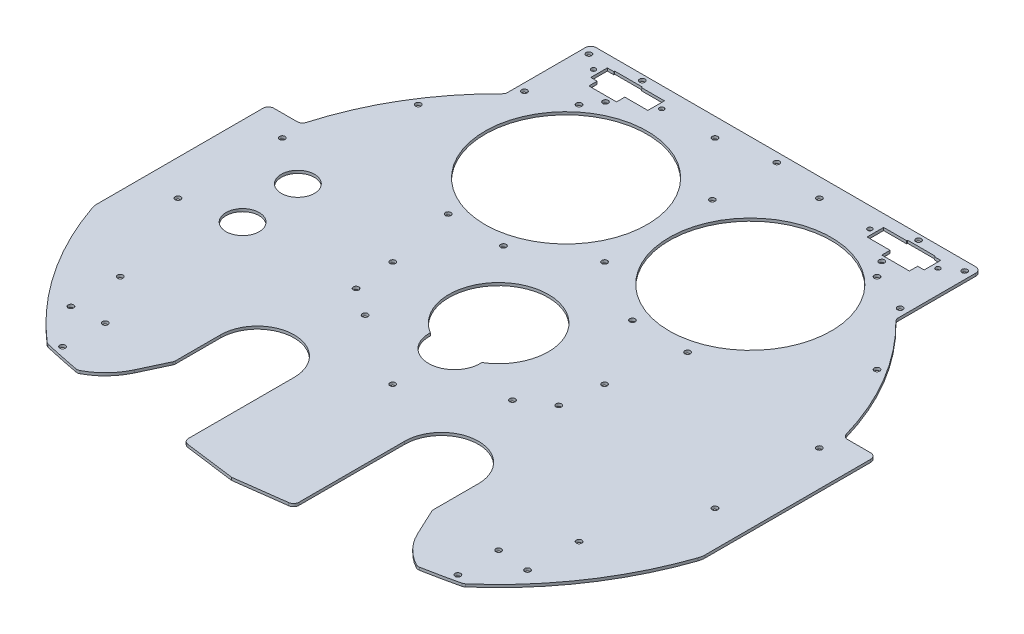
from build123d import *

# Parameters (mm, degrees)
BOSS_EXTRU_1_DEPTH           = 1.5
ESQUISSE2_R                  = 1.5
ENL_V_MAT_EXTRU_1_DEPTH      = 10
ENL_V_MAT_EXTRU_2_REACH      = 231.842
ESQUISSE3_R                  = 44
ESQUISSE3_R_2                = 1.25
ESQUISSE3_W                  = 31
ESQUISSE3_H                  = 9
ENL_V_MAT_EXTRU_3_REACH      = 231.842
ESQUISSE4_R                  = 1.5
CONG_1_R                     = 3
ESQUISSE5_R                  = 9
ENL_V_MAT_EXTRU_4_DEPTH      = 230.841793557
ESQUISSE6_R                  = 1.5
ENL_V_MAT_EXTRU_5_DEPTH      = 230.841793557
R_P_TITION_CIRCULAIRE1_COUNT = 3
R_P_TITION_CIRCULAIRE1_ANGLE = 180
ESQUISSE7_R                  = 1.5
ENL_V_MAT_EXTRU_6_DEPTH      = 230.841793557
CONG_2_R                     = 10
CONG_3_R                     = 3
ESQUISSE8_R                  = 1.5
ESQUISSE8_W                  = 15
ESQUISSE8_H                  = 14
ENL_V_MAT_EXTRU_7_DEPTH      = 228.075428139
ESQUISSE9_R                  = 1.5
ENL_V_MAT_EXTRU_8_DEPTH      = 3
ESQUISSE10_R                 = 1.5
ENL_V_MAT_EXTRU_9_DEPTH      = 228.075428139


with BuildPart() as part:
    # Esquisse1 → Boss.-Extru.1 (new body)
    with BuildSketch(Plane(origin=(0, 0, 0), x_dir=(1, 0, 0), z_dir=(0, 1, 0))):
        with BuildLine():
            Line((165, -54.556978373), (165, 55.241669751))
            Line((165, 55.241669751), (104.517749831, 160))
            Line((104.517749831, 160), (-104.517749831, 160))
            Line((-104.517749831, 160), (-165, 55.241669751))
            Line((-165, 55.241669751), (-165, -54.556978373))
            ThreePointArc((-165, -54.556978373), (-144.278322914, -96.877393783), (-112.949332972, -132.075402973))
            ThreePointArc((-112.949332972, -132.075402973), (0, -145), (112.949332972, -132.075402973))
            ThreePointArc((112.949332972, -132.075402973), (144.278322914, -96.877393783), (165, -54.556978373))
        make_face()
    extrude(amount=BOSS_EXTRU_1_DEPTH)

    # Esquisse2 → Enlèv. mat.-Extru.1 (cut)
    with BuildSketch(Plane(origin=(0, 1.5, 0), x_dir=(1, 0, 0), z_dir=(0, 1, 0))):
        with Locations(Location((0, 57.5, 0), (0, 0, 270))):
            Circle(ESQUISSE2_R)
        with Locations(Location((57.5, 0, 0), (0, 0, 270))):
            Circle(ESQUISSE2_R)
        with Locations(Location((-57.5, 0, 0), (0, 0, 270))):
            Circle(ESQUISSE2_R)
        with Locations(Location((0, -57.5, 0), (0, 0, 270))):
            Circle(ESQUISSE2_R)
        with BuildLine():
            ThreePointArc((13.971309267, -23.104166667), (0, 27), (-13.971309267, -23.104166667))
            ThreePointArc((-13.971309267, -23.104166667), (0, -38), (13.971309267, -23.104166667))
        make_face()
    extrude(amount=-ENL_V_MAT_EXTRU_1_DEPTH, mode=Mode.SUBTRACT)

    # Esquisse3 → Enlèv. mat.-Extru.2 (cut, up to next)
    with BuildSketch(Plane(origin=(0, 1.5, 0), x_dir=(1, 0, 0), z_dir=(0, 1, 0)), mode=Mode.PRIVATE) as enl_v_mat_extru_2_sk1:
        with Locations(Location((-50, 86.602540378, 0), (0, 0, 270))):
            Circle(ESQUISSE3_R)
    enl_v_mat_extru_2_tool1 = extrude(enl_v_mat_extru_2_sk1.sketch, amount=-ENL_V_MAT_EXTRU_2_REACH, mode=Mode.PRIVATE) & part.part
    # Esquisse3 → Enlèv. mat.-Extru.2 (cut, up to next)
    with BuildSketch(Plane(origin=(0, 1.5, 0), x_dir=(1, 0, 0), z_dir=(0, 1, 0)), mode=Mode.PRIVATE) as enl_v_mat_extru_2_sk2:
        with Locations(Location((50, 86.602540378, 0), (0, 0, 270))):
            Circle(ESQUISSE3_R)
    enl_v_mat_extru_2_tool2 = extrude(enl_v_mat_extru_2_sk2.sketch, amount=-ENL_V_MAT_EXTRU_2_REACH, mode=Mode.PRIVATE) & part.part
    # Esquisse3 → Enlèv. mat.-Extru.2 (cut, up to next)
    with BuildSketch(Plane(origin=(0, 1.5, 0), x_dir=(1, 0, 0), z_dir=(0, 1, 0)), mode=Mode.PRIVATE) as enl_v_mat_extru_2_sk3:
        with Locations(Location((-93.5, 145, 0), (0, 0, 270))):
            Circle(ESQUISSE3_R_2)
    enl_v_mat_extru_2_tool3 = extrude(enl_v_mat_extru_2_sk3.sketch, amount=-ENL_V_MAT_EXTRU_2_REACH, mode=Mode.PRIVATE) & part.part
    # Esquisse3 → Enlèv. mat.-Extru.2 (cut, up to next)
    with BuildSketch(Plane(origin=(0, 1.5, 0), x_dir=(1, 0, 0), z_dir=(0, 1, 0)), mode=Mode.PRIVATE) as enl_v_mat_extru_2_sk4:
        with Locations(Location((-56.5, 145, 0), (0, 0, 270))):
            Circle(ESQUISSE3_R_2)
    enl_v_mat_extru_2_tool4 = extrude(enl_v_mat_extru_2_sk4.sketch, amount=-ENL_V_MAT_EXTRU_2_REACH, mode=Mode.PRIVATE) & part.part
    # Esquisse3 → Enlèv. mat.-Extru.2 (cut, up to next)
    with BuildSketch(Plane(origin=(0, 1.5, 0), x_dir=(1, 0, 0), z_dir=(0, 1, 0)), mode=Mode.PRIVATE) as enl_v_mat_extru_2_sk5:
        with Locations(Location((56.5, 145, 0), (0, 0, 270))):
            Circle(ESQUISSE3_R_2)
    enl_v_mat_extru_2_tool5 = extrude(enl_v_mat_extru_2_sk5.sketch, amount=-ENL_V_MAT_EXTRU_2_REACH, mode=Mode.PRIVATE) & part.part
    # Esquisse3 → Enlèv. mat.-Extru.2 (cut, up to next)
    with BuildSketch(Plane(origin=(0, 1.5, 0), x_dir=(1, 0, 0), z_dir=(0, 1, 0)), mode=Mode.PRIVATE) as enl_v_mat_extru_2_sk6:
        with Locations(Location((93.5, 145, 0), (0, 0, 270))):
            Circle(ESQUISSE3_R_2)
    enl_v_mat_extru_2_tool6 = extrude(enl_v_mat_extru_2_sk6.sketch, amount=-ENL_V_MAT_EXTRU_2_REACH, mode=Mode.PRIVATE) & part.part
    # Esquisse3 → Enlèv. mat.-Extru.2 (cut, up to next)
    with BuildSketch(Plane(origin=(0, 1.5, 0), x_dir=(1, 0, 0), z_dir=(0, 1, 0)), mode=Mode.PRIVATE) as enl_v_mat_extru_2_sk7:
        with Locations((-75, 145)):
            Rectangle(ESQUISSE3_W, ESQUISSE3_H)
    enl_v_mat_extru_2_tool7 = extrude(enl_v_mat_extru_2_sk7.sketch, amount=-ENL_V_MAT_EXTRU_2_REACH, mode=Mode.PRIVATE) & part.part
    # Esquisse3 → Enlèv. mat.-Extru.2 (cut, up to next)
    with BuildSketch(Plane(origin=(0, 1.5, 0), x_dir=(1, 0, 0), z_dir=(0, 1, 0)), mode=Mode.PRIVATE) as enl_v_mat_extru_2_sk8:
        with BuildLine():
            Line((70, -145), (70, -81))
            ThreePointArc((70, -81), (50, -61), (30, -81))
            Line((30, -81), (30, -145))
            Line((30, -145), (70, -145))
        make_face()
    enl_v_mat_extru_2_tool8 = extrude(enl_v_mat_extru_2_sk8.sketch, amount=-ENL_V_MAT_EXTRU_2_REACH, mode=Mode.PRIVATE) & part.part
    # Esquisse3 → Enlèv. mat.-Extru.2 (cut, up to next)
    with BuildSketch(Plane(origin=(0, 1.5, 0), x_dir=(1, 0, 0), z_dir=(0, 1, 0)), mode=Mode.PRIVATE) as enl_v_mat_extru_2_sk9:
        with BuildLine():
            Line((-30, -145), (-70, -145))
            Line((-70, -145), (-70, -81))
            ThreePointArc((-70, -81), (-50, -61), (-30, -81))
            Line((-30, -81), (-30, -145))
        make_face()
    enl_v_mat_extru_2_tool9 = extrude(enl_v_mat_extru_2_sk9.sketch, amount=-ENL_V_MAT_EXTRU_2_REACH, mode=Mode.PRIVATE) & part.part
    # Esquisse3 → Enlèv. mat.-Extru.2 (cut, up to next)
    with BuildSketch(Plane(origin=(0, 1.5, 0), x_dir=(1, 0, 0), z_dir=(0, 1, 0)), mode=Mode.PRIVATE) as enl_v_mat_extru_2_sk10:
        with Locations((75, 145)):
            Rectangle(ESQUISSE3_W, ESQUISSE3_H)
    enl_v_mat_extru_2_tool10 = extrude(enl_v_mat_extru_2_sk10.sketch, amount=-ENL_V_MAT_EXTRU_2_REACH, mode=Mode.PRIVATE) & part.part
    add(enl_v_mat_extru_2_tool1.solids().sort_by_distance((-50, 1.5, -86.60254))[0], mode=Mode.SUBTRACT)
    add(enl_v_mat_extru_2_tool2.solids().sort_by_distance((50, 1.5, -86.60254))[0], mode=Mode.SUBTRACT)
    add(enl_v_mat_extru_2_tool3.solids().sort_by_distance((-93.5, 1.5, -145))[0], mode=Mode.SUBTRACT)
    add(enl_v_mat_extru_2_tool4.solids().sort_by_distance((-56.5, 1.5, -145))[0], mode=Mode.SUBTRACT)
    add(enl_v_mat_extru_2_tool5.solids().sort_by_distance((56.5, 1.5, -145))[0], mode=Mode.SUBTRACT)
    add(enl_v_mat_extru_2_tool6.solids().sort_by_distance((93.5, 1.5, -145))[0], mode=Mode.SUBTRACT)
    add(enl_v_mat_extru_2_tool7.solids().sort_by_distance((-75, 1.5, -145))[0], mode=Mode.SUBTRACT)
    add(enl_v_mat_extru_2_tool8.solids().sort_by_distance((50, 1.5, 105.021021))[0], mode=Mode.SUBTRACT)
    add(enl_v_mat_extru_2_tool9.solids().sort_by_distance((-50, 1.5, 105.021021))[0], mode=Mode.SUBTRACT)
    add(enl_v_mat_extru_2_tool10.solids().sort_by_distance((75, 1.5, -145))[0], mode=Mode.SUBTRACT)

    # Esquisse4 → Enlèv. mat.-Extru.3 (cut, up to next)
    with BuildSketch(Plane(origin=(0, 1.5, 0), x_dir=(1, 0, 0), z_dir=(0, 1, 0)), mode=Mode.PRIVATE) as enl_v_mat_extru_3_sk1:
        with Locations(Location((-106.773123959, -106.773123959, 0), (0, 0, 270))):
            Circle(ESQUISSE4_R)
    enl_v_mat_extru_3_tool1 = extrude(enl_v_mat_extru_3_sk1.sketch, amount=-ENL_V_MAT_EXTRU_3_REACH, mode=Mode.PRIVATE) & part.part
    # Esquisse4 → Enlèv. mat.-Extru.3 (cut, up to next)
    with BuildSketch(Plane(origin=(0, 1.5, 0), x_dir=(1, 0, 0), z_dir=(0, 1, 0)), mode=Mode.PRIVATE) as enl_v_mat_extru_3_sk2:
        with Locations(Location((106.773123959, -106.773123959, 0), (0, 0, 270))):
            Circle(ESQUISSE4_R)
    enl_v_mat_extru_3_tool2 = extrude(enl_v_mat_extru_3_sk2.sketch, amount=-ENL_V_MAT_EXTRU_3_REACH, mode=Mode.PRIVATE) & part.part
    # Esquisse4 → Enlèv. mat.-Extru.3 (cut, up to next)
    with BuildSketch(Plane(origin=(0, 1.5, 0), x_dir=(1, 0, 0), z_dir=(0, 1, 0)), mode=Mode.PRIVATE) as enl_v_mat_extru_3_sk3:
        with Locations(Location((107.303108891, -129.437836945, 0), (0, 0, 270))):
            Circle(ESQUISSE4_R)
    enl_v_mat_extru_3_tool3 = extrude(enl_v_mat_extru_3_sk3.sketch, amount=-ENL_V_MAT_EXTRU_3_REACH, mode=Mode.PRIVATE) & part.part
    # Esquisse4 → Enlèv. mat.-Extru.3 (cut, up to next)
    with BuildSketch(Plane(origin=(0, 1.5, 0), x_dir=(1, 0, 0), z_dir=(0, 1, 0)), mode=Mode.PRIVATE) as enl_v_mat_extru_3_sk4:
        with Locations(Location((123.953743986, -108.277582907, 0), (0, 0, 270))):
            Circle(ESQUISSE4_R)
    enl_v_mat_extru_3_tool4 = extrude(enl_v_mat_extru_3_sk4.sketch, amount=-ENL_V_MAT_EXTRU_3_REACH, mode=Mode.PRIVATE) & part.part
    # Esquisse4 → Enlèv. mat.-Extru.3 (cut, up to next)
    with BuildSketch(Plane(origin=(0, 1.5, 0), x_dir=(1, 0, 0), z_dir=(0, 1, 0)), mode=Mode.PRIVATE) as enl_v_mat_extru_3_sk5:
        with Locations(Location((-123.953743986, -108.277582907, 0), (0, 0, 270))):
            Circle(ESQUISSE4_R)
    enl_v_mat_extru_3_tool5 = extrude(enl_v_mat_extru_3_sk5.sketch, amount=-ENL_V_MAT_EXTRU_3_REACH, mode=Mode.PRIVATE) & part.part
    # Esquisse4 → Enlèv. mat.-Extru.3 (cut, up to next)
    with BuildSketch(Plane(origin=(0, 1.5, 0), x_dir=(1, 0, 0), z_dir=(0, 1, 0)), mode=Mode.PRIVATE) as enl_v_mat_extru_3_sk6:
        with Locations(Location((-107.303108891, -129.437836945, 0), (0, 0, 270))):
            Circle(ESQUISSE4_R)
    enl_v_mat_extru_3_tool6 = extrude(enl_v_mat_extru_3_sk6.sketch, amount=-ENL_V_MAT_EXTRU_3_REACH, mode=Mode.PRIVATE) & part.part
    # Esquisse4 → Enlèv. mat.-Extru.3 (cut, up to next)
    with BuildSketch(Plane(origin=(0, 1.5, 0), x_dir=(1, 0, 0), z_dir=(0, 1, 0)), mode=Mode.PRIVATE) as enl_v_mat_extru_3_sk7:
        with BuildLine():
            Line((-70, -105.997557384), (-76.864966987, -120.719526597))
            ThreePointArc((-76.864966987, -120.719526597), (-89.156485892, -134.677497509), (-107.043695945, -139.77201471))
            Line((-107.043695945, -139.77201471), (-70, -140.075751779))
            Line((-70, -140.075751779), (-70, -105.997557384))
        make_face()
    enl_v_mat_extru_3_tool7 = extrude(enl_v_mat_extru_3_sk7.sketch, amount=-ENL_V_MAT_EXTRU_3_REACH, mode=Mode.PRIVATE) & part.part
    # Esquisse4 → Enlèv. mat.-Extru.3 (cut, up to next)
    with BuildSketch(Plane(origin=(0, 1.5, 0), x_dir=(1, 0, 0), z_dir=(0, 1, 0)), mode=Mode.PRIVATE) as enl_v_mat_extru_3_sk8:
        with BuildLine():
            Line((70, -105.997557384), (70, -140.075751779))
            Line((70, -140.075751779), (107.043695945, -139.77201471))
            ThreePointArc((107.043695945, -139.77201471), (89.156485892, -134.677497509), (76.864966987, -120.719526597))
            Line((76.864966987, -120.719526597), (70, -105.997557384))
        make_face()
    enl_v_mat_extru_3_tool8 = extrude(enl_v_mat_extru_3_sk8.sketch, amount=-ENL_V_MAT_EXTRU_3_REACH, mode=Mode.PRIVATE) & part.part
    # Esquisse4 → Enlèv. mat.-Extru.3 (cut, up to next)
    with BuildSketch(Plane(origin=(0, 1.5, 0), x_dir=(1, 0, 0), z_dir=(0, 1, 0)), mode=Mode.PRIVATE) as enl_v_mat_extru_3_sk9:
        Polygon((-30, -145), (30, -145), (30, -141.012303502), (0, -144.961878429), (-30, -141.012303502), align=None)
    enl_v_mat_extru_3_tool9 = extrude(enl_v_mat_extru_3_sk9.sketch, amount=-ENL_V_MAT_EXTRU_3_REACH, mode=Mode.PRIVATE) & part.part
    add(enl_v_mat_extru_3_tool1.solids().sort_by_distance((-106.773124, 1.5, 106.773124))[0], mode=Mode.SUBTRACT)
    add(enl_v_mat_extru_3_tool2.solids().sort_by_distance((106.773124, 1.5, 106.773124))[0], mode=Mode.SUBTRACT)
    add(enl_v_mat_extru_3_tool3.solids().sort_by_distance((107.303109, 1.5, 129.437837))[0], mode=Mode.SUBTRACT)
    add(enl_v_mat_extru_3_tool4.solids().sort_by_distance((123.953744, 1.5, 108.277583))[0], mode=Mode.SUBTRACT)
    add(enl_v_mat_extru_3_tool5.solids().sort_by_distance((-123.953744, 1.5, 108.277583))[0], mode=Mode.SUBTRACT)
    add(enl_v_mat_extru_3_tool6.solids().sort_by_distance((-107.303109, 1.5, 129.437837))[0], mode=Mode.SUBTRACT)
    add(enl_v_mat_extru_3_tool7.solids().sort_by_distance((-78.222446, 1.5, 130.278178))[0], mode=Mode.SUBTRACT)
    add(enl_v_mat_extru_3_tool8.solids().sort_by_distance((78.222446, 1.5, 130.278178))[0], mode=Mode.SUBTRACT)
    add(enl_v_mat_extru_3_tool9.solids().sort_by_distance((29.398676, 1.5, 143.006152))[0], mode=Mode.SUBTRACT)

    # Congé1
    cong_1_edges = [part.edges().sort_by_distance(p)[0] for p in [
        (-112.949332972, 0.75, 132.075402973),
        (112.949332972, 0.75, 132.075402973),
        (-92.265847958, 0.75, 136.413281567),
        (-70, 0.75, 105.997557384),
        (70, 0.75, 105.997557384),
        (92.265847958, 0.75, 136.413281567),
        (-30, 0.75, 141.012303502),
        (30, 0.75, 141.012303502),
    ]]
    fillet(cong_1_edges, radius=CONG_1_R)

    # Esquisse5 → Enlèv. mat.-Extru.4 (cut, through all)
    with BuildSketch(Plane(origin=(0, 1.5, 0), x_dir=(1, 0, 0), z_dir=(0, 1, 0))):
        with Locations(Location((-120, 11, 0), (0, 0, 270))):
            Circle(ESQUISSE5_R)
        with Locations(Location((-117, -22, 0), (0, 0, 270))):
            Circle(ESQUISSE5_R)
    extrude(amount=-ENL_V_MAT_EXTRU_4_DEPTH, mode=Mode.SUBTRACT)

    # Esquisse6 → Enlèv. mat.-Extru.5 (cut, through all)
    with BuildSketch(Plane(origin=(0, 1.5, 0), x_dir=(1, 0, 0), z_dir=(0, 1, 0))):
        with Locations(Location((-124.54257934, -80.8788967, 0), (0, 0, 270))):
            Circle(ESQUISSE6_R)
        with Locations(Location((-145.771636742, -28.335135813, 0), (0, 0, 270))):
            Circle(ESQUISSE6_R)
        with Locations(Location((-145.771636742, 28.335135813, 0), (0, 0, 270))):
            Circle(ESQUISSE6_R)
        with Locations(Location((-124.54257934, 80.8788967, 0), (0, 0, 270))):
            Circle(ESQUISSE6_R)
    enl_v_mat_extru_5 = extrude(amount=-ENL_V_MAT_EXTRU_5_DEPTH, mode=Mode.SUBTRACT)

    # Répétition circulaire1: Enlèv. mat.-Extru.5 ×3 about axis
    r_p_tition_circulaire1_axis = Axis((0, 0, 0), (0, -1, 0))
    for i in range(1, R_P_TITION_CIRCULAIRE1_COUNT):
        add(enl_v_mat_extru_5.rotate(r_p_tition_circulaire1_axis, i * R_P_TITION_CIRCULAIRE1_ANGLE / (R_P_TITION_CIRCULAIRE1_COUNT - 1)), mode=Mode.SUBTRACT)

    # Esquisse7 → Enlèv. mat.-Extru.6 (cut, through all)
    with BuildSketch(Plane(origin=(0, 1.5, 0), x_dir=(1, 0, 0), z_dir=(0, 1, 0))):
        with Locations(Location((-65, 37.6, 0), (0, 0, 270))):
            Circle(ESQUISSE7_R)
        with Locations(Location((-35, 37.6, 0), (0, 0, 270))):
            Circle(ESQUISSE7_R)
        with Locations(Location((-55, -22.4, 0), (0, 0, 270))):
            Circle(ESQUISSE7_R)
        with Locations(Location((55, -22.4, 0), (0, 0, 90))):
            Circle(ESQUISSE7_R)
        with Locations(Location((35, 37.6, 0), (0, 0, 90))):
            Circle(ESQUISSE7_R)
        with Locations(Location((65, 37.6, 0), (0, 0, 90))):
            Circle(ESQUISSE7_R)
        with BuildLine():
            Line((-165, 55.241669751), (-165, 40))
            Line((-165, 40), (-147.160626528, 40))
            ThreePointArc((-147.160626528, 40), (-131.281758792, 77.597356968), (-106, 109.636900722))
            Line((-106, 109.636900722), (-106, 156))
            Line((-106, 156), (106, 156))
            Line((106, 156), (106, 109.636900722))
            ThreePointArc((106, 109.636900722), (131.281758792, 77.597356968), (147.160626528, 40))
            Line((147.160626528, 40), (165, 40))
            Line((165, 40), (165, 55.241669751))
            Line((165, 55.241669751), (104.517749831, 160))
            Line((104.517749831, 160), (-104.517749831, 160))
            Line((-104.517749831, 160), (-165, 55.241669751))
        make_face()
    extrude(amount=-ENL_V_MAT_EXTRU_6_DEPTH, mode=Mode.SUBTRACT)

    # Congé2
    cong_2_edges = [part.edges().sort_by_distance(p)[0] for p in [
        (-165, 0.75, 54.556978373),
        (165, 0.75, 54.556978373),
    ]]
    fillet(cong_2_edges, radius=CONG_2_R)

    # Congé3
    cong_3_edges = [part.edges().sort_by_distance(p)[0] for p in [
        (165, 0.75, -40),
        (147.160626528, 0.75, -40),
        (106, 0.75, -109.636900722),
        (106, 0.75, -156),
        (-106, 0.75, -156),
        (-106, 0.75, -109.636900722),
        (-147.160626528, 0.75, -40),
        (-165, 0.75, -40),
    ]]
    fillet(cong_3_edges, radius=CONG_3_R)

    # Esquisse8 → Enlèv. mat.-Extru.7 (cut, through all)
    with BuildSketch(Plane(origin=(0, 1.5, 0), x_dir=(1, 0, 0), z_dir=(0, 1, 0))):
        with Locations(Location((75, 133, 0), (0, 0, 90))):
            Circle(ESQUISSE8_R)
        with Locations(Location((-75, 153, 0), (0, 0, 270))):
            Circle(ESQUISSE8_R)
        with Locations(Location((75, 153, 0), (0, 0, 90))):
            Circle(ESQUISSE8_R)
        with Locations(Location((-75, 133, 0), (0, 0, 270))):
            Circle(ESQUISSE8_R)
        with Locations((-79.5, 143)):
            Rectangle(ESQUISSE8_W, ESQUISSE8_H)
        with Locations((79.5, 143)):
            Rectangle(ESQUISSE8_W, ESQUISSE8_H)
    extrude(amount=-ENL_V_MAT_EXTRU_7_DEPTH, mode=Mode.SUBTRACT)

    # Esquisse9 → Enlèv. mat.-Extru.8 (cut)
    with BuildSketch(Plane(origin=(0, 1.5, 0), x_dir=(1, 0, 0), z_dir=(0, 1, 0))):
        with Locations(Location((-102, 151, 0), (0, 0, 270))):
            Circle(ESQUISSE9_R)
        with Locations(Location((0, 151, 0), (0, 0, 270))):
            Circle(ESQUISSE9_R)
        with Locations(Location((102, 151, 0), (0, 0, 270))):
            Circle(ESQUISSE9_R)
        with Locations(Location((0, 116, 0), (0, 0, 270))):
            Circle(ESQUISSE9_R)
        with Locations(Location((102, 116, 0), (0, 0, 270))):
            Circle(ESQUISSE9_R)
        with Locations(Location((-102, 116, 0), (0, 0, 270))):
            Circle(ESQUISSE9_R)
    extrude(amount=-ENL_V_MAT_EXTRU_8_DEPTH, mode=Mode.SUBTRACT)

    # Esquisse10 → Enlèv. mat.-Extru.9 (cut, through all)
    with BuildSketch(Plane(origin=(0, 1.5, 0), x_dir=(1, 0, 0), z_dir=(0, 1, 0))):
        with Locations(Location((-40, -32.5, 0), (0, 0, 270))):
            Circle(ESQUISSE10_R)
        with Locations(Location((40, -32.5, 0), (0, 0, 90))):
            Circle(ESQUISSE10_R)
    extrude(amount=-ENL_V_MAT_EXTRU_9_DEPTH, mode=Mode.SUBTRACT)


solid = part.part
